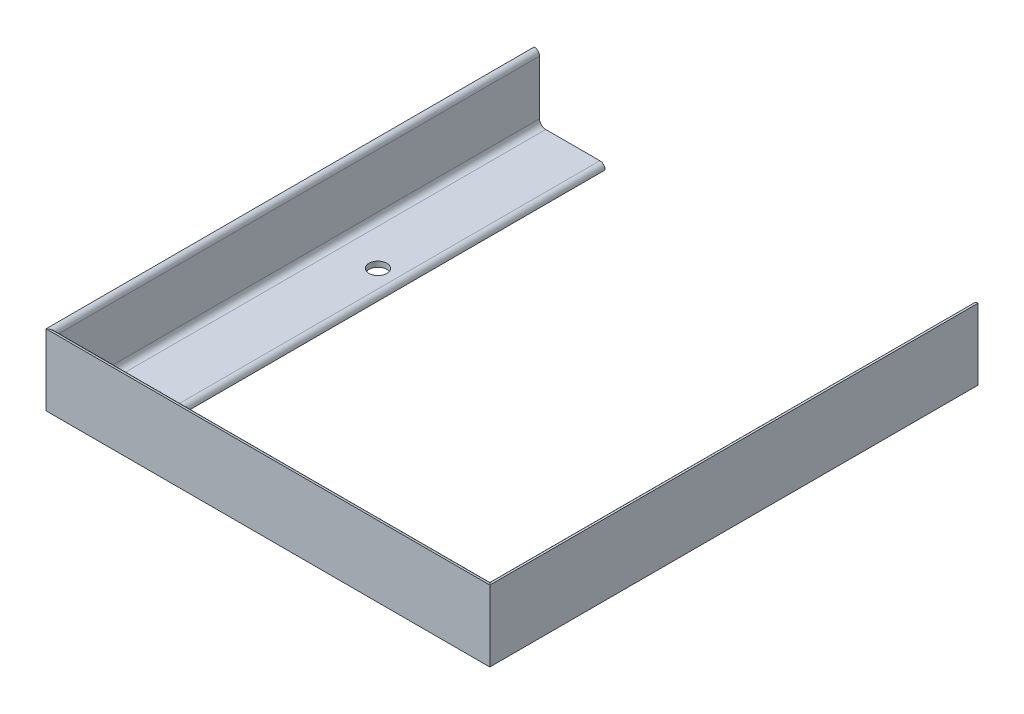
from build123d import *

# Parameters (mm, degrees)
IRON_V40X40X3_1_DEPTH        = 332.568542495
IRON_V40X40X3_1_2_DEPTH      = 365.13708499
IRON_V40X40X3_1_3_DEPTH      = 275
IRON_V40X40X3_1_3_DEPTH_BACK = 57.568542495
CUT_EXTRUDE1_START           = 10
SKETCH12_R                   = 5
CUT_EXTRUDE1_DEPTH           = 20


with BuildPart() as part:
    # Sketch11 on segment 1 (carried to segment 1) → Iron V40X40X3(1) (new body)
    with BuildSketch(Plane(origin=(125, 0, -137.5), x_dir=(0, 1, 0), z_dir=(0, 0, 1))):
        with BuildLine():
            Line((0, 0), (0, 40))
            ThreePointArc((0, 40), (2.121320344, 39.121320344), (3, 37))
            Line((3, 37), (3, 6.5))
            ThreePointArc((3, 6.5), (4.025126266, 4.025126266), (6.5, 3))
            Line((6.5, 3), (37, 3))
            ThreePointArc((37, 3), (39.121320344, 2.121320344), (40, 0))
            Line((40, 0), (0, 0))
        make_face()
    extrude(amount=IRON_V40X40X3_1_DEPTH)

    # Iron V40X40X3(1) mitre 1
    split(bisect_by=Plane(origin=(125, 0, 137.5), x_dir=(0, 1, 0), z_dir=(0.707106781, 0, -0.707106781)), keep=Keep.TOP)


with BuildPart() as body_2:
    # Sketch11 on segment 2 (carried to segment 2) → Iron V40X40X3_1 2 (new body)
    with BuildSketch(Plane(origin=(182.568542495, 0, 137.5), x_dir=(0, 1, 0), z_dir=(-1, 0, 0))):
        with BuildLine():
            Line((0, 0), (0, 40))
            ThreePointArc((0, 40), (2.121320344, 39.121320344), (3, 37))
            Line((3, 37), (3, 6.5))
            ThreePointArc((3, 6.5), (4.025126266, 4.025126266), (6.5, 3))
            Line((6.5, 3), (37, 3))
            ThreePointArc((37, 3), (39.121320344, 2.121320344), (40, 0))
            Line((40, 0), (0, 0))
        make_face()
    extrude(amount=IRON_V40X40X3_1_2_DEPTH)

    # Iron V40X40X3_1 2 mitre 1
    split(bisect_by=Plane(origin=(125, 0, 137.5), x_dir=(0, -1, 0), z_dir=(-0.707106781, 0, 0.707106781)), keep=Keep.TOP)

    # Iron V40X40X3_1 2 mitre 2
    split(bisect_by=Plane(origin=(-125, 0, 137.5), x_dir=(0, 1, 0), z_dir=(0.707106781, 0, 0.707106781)), keep=Keep.TOP)


with BuildPart() as body_3:
    # Sketch11 → Iron V40X40X3_1 3 (new, two sides: drawn at the far end of the back side and taken through both)
    with BuildSketch(Plane(origin=(-125, 0, 137.5), x_dir=(0, 1, 0), z_dir=(0, 0, -1)).offset(-IRON_V40X40X3_1_3_DEPTH_BACK)):
        with BuildLine():
            Line((0, 0), (0, 40))
            ThreePointArc((0, 40), (2.121320344, 39.121320344), (3, 37))
            Line((3, 37), (3, 6.5))
            ThreePointArc((3, 6.5), (4.025126266, 4.025126266), (6.5, 3))
            Line((6.5, 3), (37, 3))
            ThreePointArc((37, 3), (39.121320344, 2.121320344), (40, 0))
            Line((40, 0), (0, 0))
        make_face()
    extrude(amount=IRON_V40X40X3_1_3_DEPTH + IRON_V40X40X3_1_3_DEPTH_BACK)

    # Iron V40X40X3_1 3 mitre 1
    split(bisect_by=Plane(origin=(-125, 0, 137.5), x_dir=(0, -1, 0), z_dir=(-0.707106781, 0, -0.707106781)), keep=Keep.TOP)


with BuildPart() as cut_extrude1_tool:
    # Sketch12 → Cut-Extrude1 (new body)
    with BuildSketch(Plane.XZ.offset(CUT_EXTRUDE1_START)):
        with Locations((-98, 117.5)):
            Circle(SKETCH12_R)
        with Locations((98, 117.5)):
            Circle(SKETCH12_R)
        with Locations((98, -22.5)):
            Circle(SKETCH12_R)
        with Locations((-98, -22.5)):
            Circle(SKETCH12_R)
    extrude(amount=-CUT_EXTRUDE1_DEPTH)


with BuildPart() as part_1:
    add(part.part)

    # Cut-Extrude1: cut by cut_extrude1_tool
    add(cut_extrude1_tool.part, mode=Mode.SUBTRACT)


with BuildPart() as body_2_1:
    add(body_2.part)

    # Cut-Extrude1: cut by cut_extrude1_tool
    add(cut_extrude1_tool.part, mode=Mode.SUBTRACT)


with BuildPart() as body_3_1:
    add(body_3.part)

    # Cut-Extrude1: cut by cut_extrude1_tool
    add(cut_extrude1_tool.part, mode=Mode.SUBTRACT)


solid = Compound([part_1.part, body_2_1.part, body_3_1.part])
